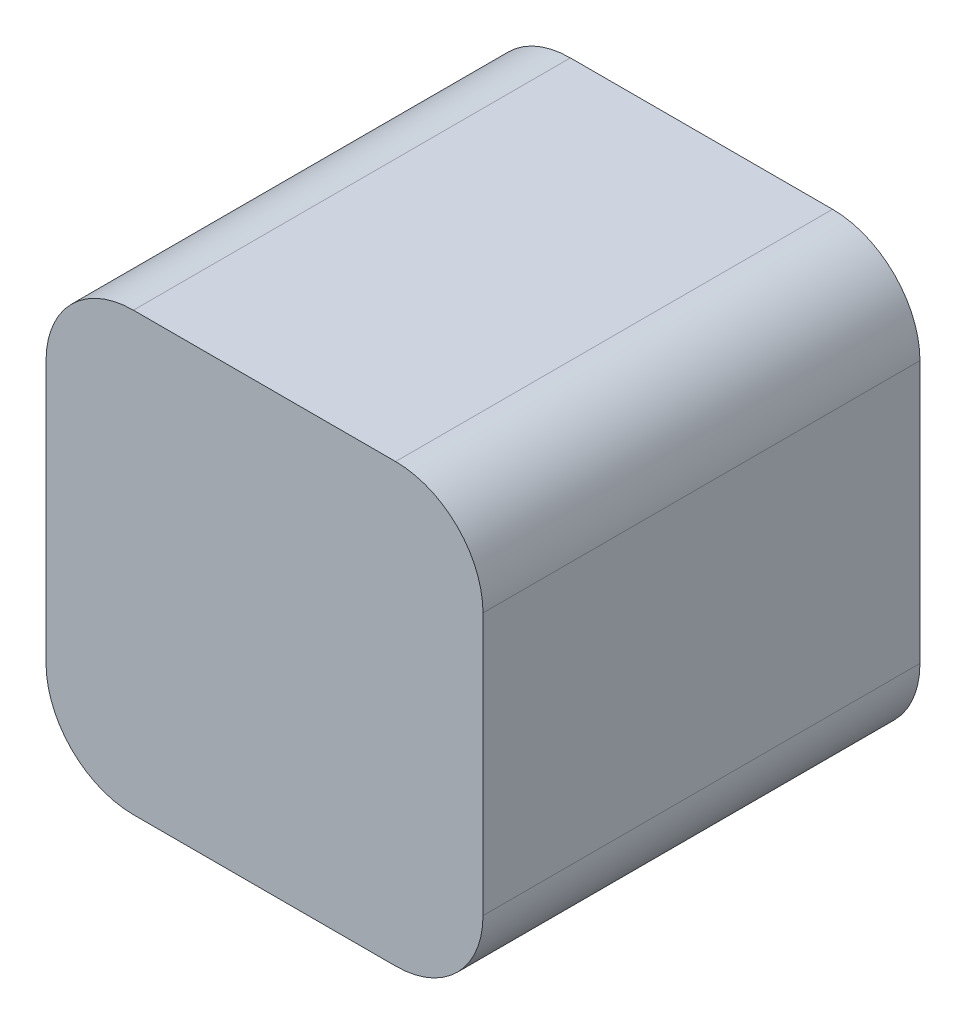
from build123d import *

# Parameters (mm, degrees)
CROQUIS1_W              = 50
CROQUIS1_H              = 50
SALIENTE_EXTRUIR1_DEPTH = 50
REDONDEO1_R             = 10


with BuildPart() as part:
    # Croquis1 → Saliente-Extruir1 (new body)
    with BuildSketch(Plane(origin=(0, 0, 0), x_dir=(0, 0, -1), z_dir=(1, 0, 0))):
        with Locations((25, 25)):
            Rectangle(CROQUIS1_W, CROQUIS1_H)
    extrude(amount=SALIENTE_EXTRUIR1_DEPTH)

    # Redondeo1
    redondeo1_edges = [part.edges().sort_by_distance(p)[0] for p in [
        (50, 50, -25),
        (0, 50, -25),
        (0, 0, -25),
        (50, 0, -25),
    ]]
    fillet(redondeo1_edges, radius=REDONDEO1_R)


solid = part.part
